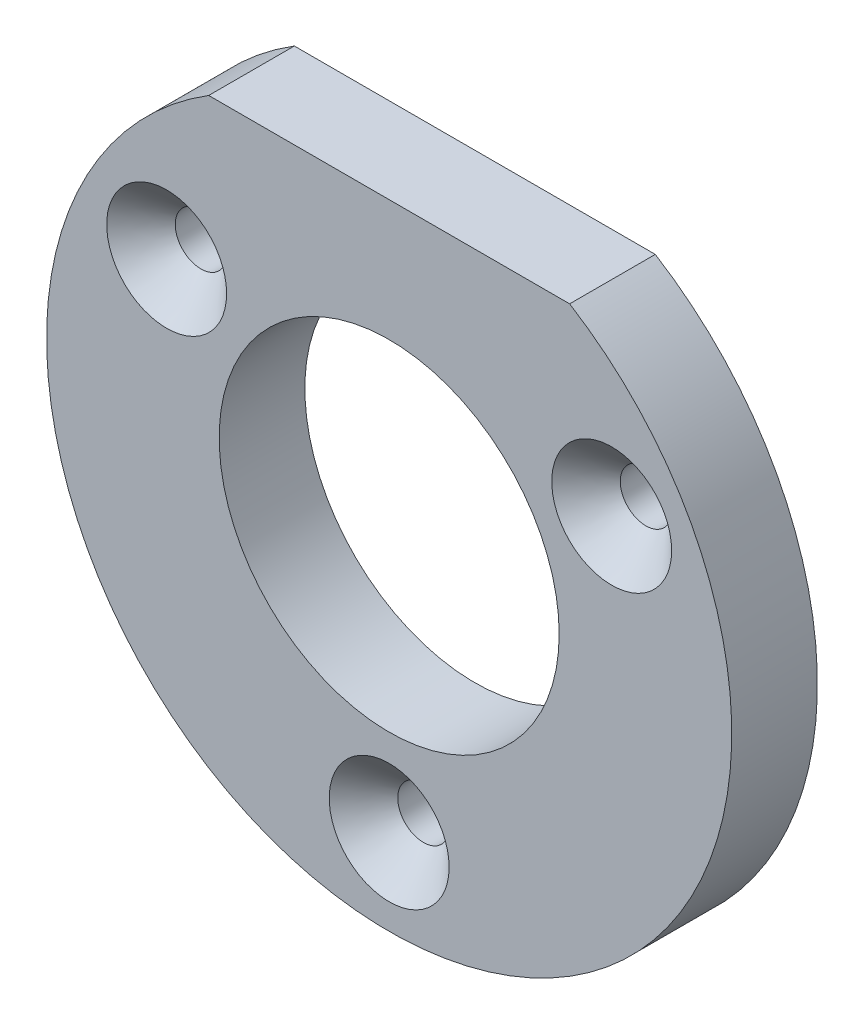
from build123d import *

# Parameters (mm, degrees)
SKETCH1_R           = 9.925
BOSS_EXTRUDE1_DEPTH = 5
SKETCH2_R           = 1.5
CUT_EXTRUDE1_DEPTH  = 29.722813233
CIRPATTERN1_COUNT   = 3
CHAMFER1_SIZE       = 2


with BuildPart() as part:
    # Sketch1 → Boss-Extrude1 (new body)
    with BuildSketch(Plane.XY):
        with BuildLine():
            Line((10.535653753, 17), (-10.535653753, 17))
            ThreePointArc((-10.535653753, 17), (0, -20), (10.535653753, 17))
        make_face()
        Circle(SKETCH1_R, mode=Mode.SUBTRACT)
    extrude(amount=BOSS_EXTRUDE1_DEPTH)

    # Sketch2 → Cut-Extrude1 (cut, through all)
    with BuildSketch(Plane.XY.offset(5)):
        with Locations((0, -15)):
            Circle(SKETCH2_R)
    cut_extrude1 = extrude(amount=-CUT_EXTRUDE1_DEPTH, mode=Mode.SUBTRACT)

    # CirPattern1: Cut-Extrude1 ×3 about axis
    cirpattern1_axis = Axis((0, 0, 0), (0, 0, 1))
    for i in range(1, CIRPATTERN1_COUNT):
        add(cut_extrude1.rotate(cirpattern1_axis, i * 360 / CIRPATTERN1_COUNT), mode=Mode.SUBTRACT)

    # Chamfer1
    chamfer1_edges = [part.edges().sort_by_distance(p)[0] for p in [
        (-1.5, -15, 5),
        (13.740381057, 6.200961894, 5),
        (-12.240381057, 8.799038106, 5),
    ]]
    chamfer(chamfer1_edges, length=CHAMFER1_SIZE)


solid = part.part
